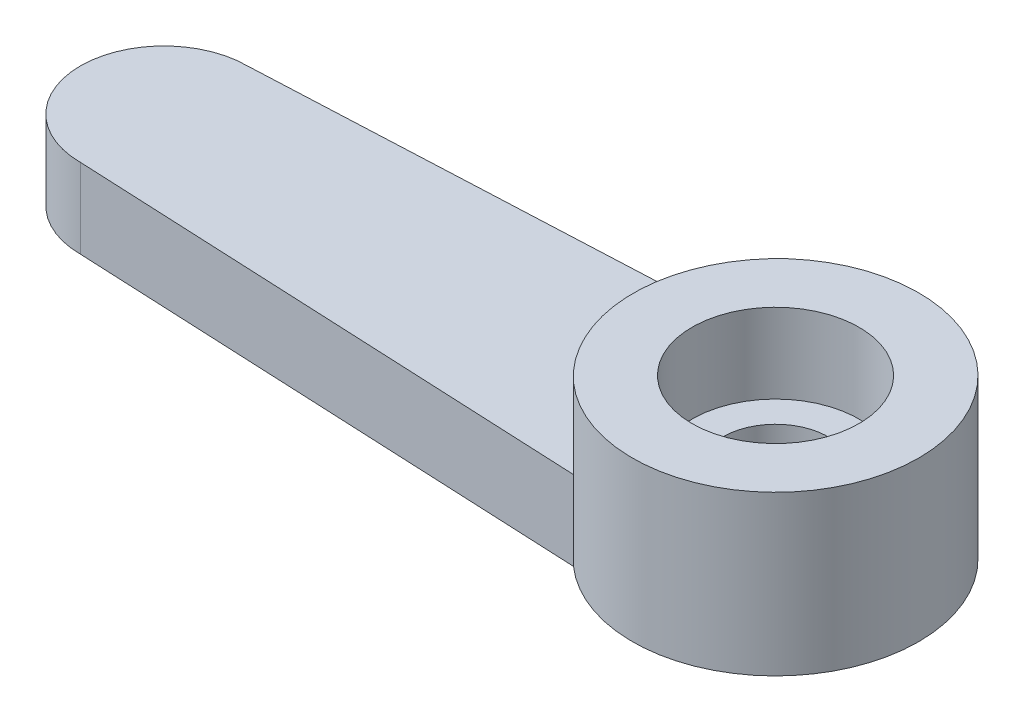
from build123d import *

# Parameters (mm, degrees)
BOSS_EXTRUDE1_DEPTH     = 1
BOSS_EXTRUDE3_START     = 2
SKETCH2_R               = 2.1
BOSS_EXTRUDE3_DEPTH     = 2
CUT_EXTRUDE1_DEPTH      = 18.959719392
CUT_EXTRUDE1_DEPTH_BACK = 18.959719392
SKETCH3_R               = 1.325


with BuildPart() as part:
    # Sketch1 → Boss-Extrude1 (new, symmetric)
    with BuildSketch(Plane(origin=(0, 0, 0), x_dir=(1, 0, 0), z_dir=(0, 1, 0))):
        with BuildLine():
            ThreePointArc((-15.38117618, 2.1), (-17.48117618, 0), (-15.38117618, -2.1))
            Line((-15.38117618, -2.1), (-2.38117618, -2.7))
            ThreePointArc((-2.38117618, -2.7), (3.6, 0), (-2.38117618, 2.7))
            Line((-2.38117618, 2.7), (-15.38117618, 2.1))
        make_face()
    extrude(amount=BOSS_EXTRUDE1_DEPTH, both=True)

    # Sketch2 → Boss-Extrude3 (add)
    with BuildSketch(Plane(origin=(0, 1, 0), x_dir=(1, 0, 0), z_dir=(0, 1, 0)).offset(BOSS_EXTRUDE3_START)):
        with BuildLine():
            ThreePointArc((-2.38117618, 2.7), (-3.579161976, 0), (-2.38117618, -2.7))
            ThreePointArc((-2.38117618, -2.7), (3.6, 0), (-2.38117618, 2.7))
        make_face()
        with Locations(Location((0, 0, 0), (0, 0, 270))):
            Circle(SKETCH2_R, mode=Mode.SUBTRACT)
    extrude(amount=-BOSS_EXTRUDE3_DEPTH)

    # Sketch3 → Cut-Extrude1 (cut, two sides: drawn at the far end of the back side and taken through both)
    with BuildSketch(Plane(origin=(0, 1, 0), x_dir=(1, 0, 0), z_dir=(0, 1, 0)).offset(-CUT_EXTRUDE1_DEPTH_BACK)):
        with Locations(Location((0, 0, 0), (0, 0, 270))):
            Circle(SKETCH3_R)
    extrude(amount=CUT_EXTRUDE1_DEPTH + CUT_EXTRUDE1_DEPTH_BACK, mode=Mode.SUBTRACT)


solid = part.part
